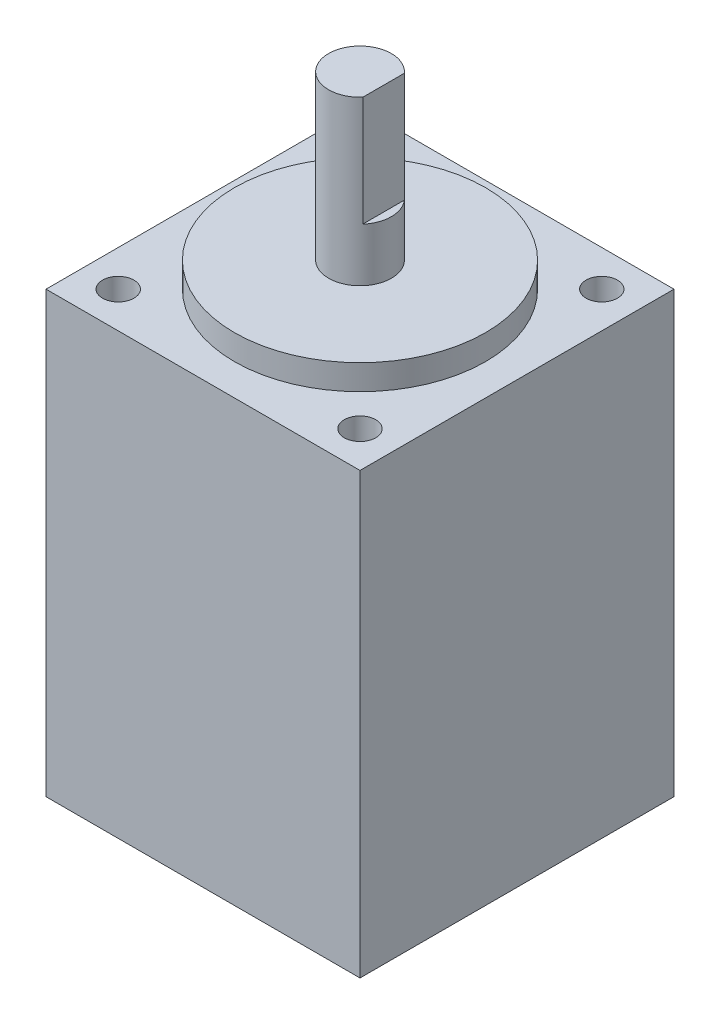
from build123d import *

# Parameters (mm, degrees)
SKETCH_1_W          = 20
SKETCH_1_H          = 20
SKETCH_1_R          = 1
EXTRUDE_1_DEPTH     = 28
EXTRUDE_2_DEPTH     = 1.6
SKETCH_3_R          = 2
EXTRUDE_3_DEPTH     = 10.4
CUT_EXTRUDE_START   = -7
CUT_EXTRUDE_4_DEPTH = 7


with BuildPart() as part:
    # 草图1 → 凸台-拉伸1 (new body)
    with BuildSketch(Plane(origin=(0, 0, 0), x_dir=(1, 0, 0), z_dir=(0, 1, 0))):
        with Locations((10, 10)):
            Rectangle(SKETCH_1_W, SKETCH_1_H)
        with Locations(Location((17.7, 2.3, 0), (0, 0, 270))):
            Circle(SKETCH_1_R, mode=Mode.SUBTRACT)
        with Locations(Location((17.7, 17.7, 0), (0, 0, 270))):
            Circle(SKETCH_1_R, mode=Mode.SUBTRACT)
        with Locations(Location((2.3, 17.7, 0), (0, 0, 270))):
            Circle(SKETCH_1_R, mode=Mode.SUBTRACT)
        with Locations(Location((2.3, 2.3, 0), (0, 0, 270))):
            Circle(SKETCH_1_R, mode=Mode.SUBTRACT)
    extrude(amount=EXTRUDE_1_DEPTH)

    # 草图2 → 凸台-拉伸2 (add)
    with BuildSketch(Plane(origin=(0, 28, 0), x_dir=(1, 0, 0), z_dir=(0, 1, 0))):
        with BuildLine():
            ThreePointArc((2, 10), (10, 2), (18, 10))
            Line((18, 10), (2, 10))
        make_face()
        with BuildLine():
            Line((2, 10), (18, 10))
            ThreePointArc((18, 10), (10, 18), (2, 10))
        make_face()
    extrude(amount=EXTRUDE_2_DEPTH)

    # 草图3 → 凸台-拉伸3 (add)
    with BuildSketch(Plane(origin=(0, 29.6, 0), x_dir=(1, 0, 0), z_dir=(0, 1, 0))):
        with Locations(Location((10, 10, 0), (0, 0, 270))):
            Circle(SKETCH_3_R)
    extrude(amount=EXTRUDE_3_DEPTH)

    # 草图4 → 切除-拉伸4 (cut)
    with BuildSketch(Plane(origin=(0, 40, 0), x_dir=(1, 0, 0), z_dir=(0, 1, 0)).offset(CUT_EXTRUDE_START)):
        with BuildLine():
            Line((11.501110762, 11.321615103), (11.501110762, 10))
            Line((11.501110762, 10), (11.501110762, 8.678384897))
            ThreePointArc((11.501110762, 8.678384897), (11.871125533, 9.293679083), (12, 10))
            ThreePointArc((12, 10), (11.871125533, 10.706320917), (11.501110762, 11.321615103))
        make_face()
    extrude(amount=CUT_EXTRUDE_4_DEPTH, mode=Mode.SUBTRACT)


solid = part.part
